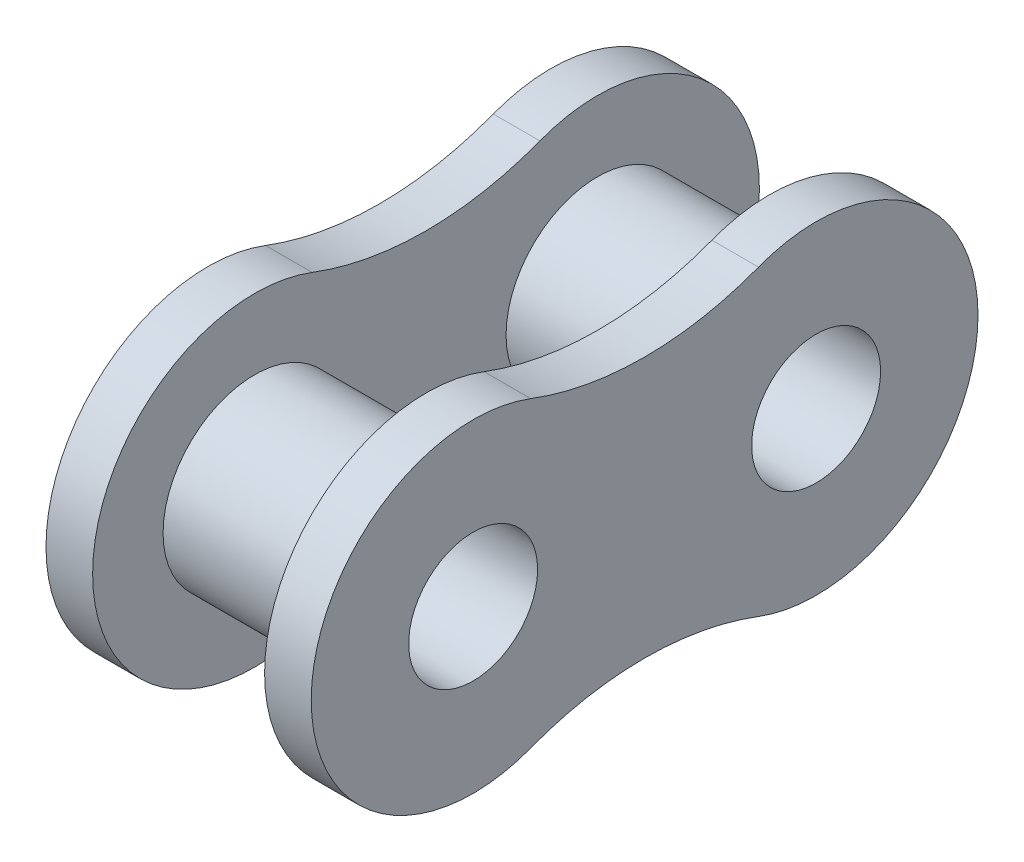
from build123d import *

# Parameters (mm, degrees)
SKETCH1_R             = 2.54
SKETCH1_R_2           = 1.7907
BOSS_EXTRUDE1_DEPTH   = 2.3876
BOSS_EXTRUDE1_2_DEPTH = 2.3876
BOSS_EXTRUDE2_START   = 2.3876
SKETCH1_4_R           = 1.7907
BOSS_EXTRUDE2_DEPTH   = 1.2954
BOSS_EXTRUDE3_START   = -2.3876
SKETCH1_5_R           = 1.7907
BOSS_EXTRUDE3_DEPTH   = 1.2954


with BuildPart() as part:
    # Sketch1 → Boss-Extrude1 (new, symmetric)
    with BuildSketch(Plane(origin=(0, 0, 0), x_dir=(0, 0, -1), z_dir=(1, 0, 0))):
        Circle(SKETCH1_R)
        Circle(SKETCH1_R_2, mode=Mode.SUBTRACT)
    extrude(amount=BOSS_EXTRUDE1_DEPTH, both=True)



with BuildPart() as body_2:
    # Sketch1 → Boss-Extrude1 2 (new, symmetric)
    with BuildSketch(Plane(origin=(0, 0, 0), x_dir=(0, 0, -1), z_dir=(1, 0, 0))):
        with Locations((9.525, 0)):
            Circle(SKETCH1_R)
        with Locations((9.525, 0)):
            Circle(SKETCH1_R_2, mode=Mode.SUBTRACT)
    extrude(amount=BOSS_EXTRUDE1_2_DEPTH, both=True)


with BuildPart() as part_1:
    add(part.part)

    add(body_2.part)  # Boss-Extrude2 merges body 2
    # Sketch1<4> → Boss-Extrude2 (add)
    with BuildSketch(Plane(origin=(0, 0, 0), x_dir=(0, 0, -1), z_dir=(1, 0, 0)).offset(BOSS_EXTRUDE2_START)):
        with BuildLine():
            ThreePointArc((7.925450664, 4.201625824), (4.7625, 3.619925475), (1.599549336, 4.201625824))
            ThreePointArc((1.599549336, 4.201625824), (-4.4958, 0), (1.599549336, -4.201625824))
            ThreePointArc((1.599549336, -4.201625824), (4.7625, -3.619925475), (7.925450664, -4.201625824))
            ThreePointArc((7.925450664, -4.201625824), (14.0208, 0), (7.925450664, 4.201625824))
        make_face()
        Circle(SKETCH1_4_R, mode=Mode.SUBTRACT)
        with Locations((9.525, 0)):
            Circle(SKETCH1_4_R, mode=Mode.SUBTRACT)
    extrude(amount=BOSS_EXTRUDE2_DEPTH)


with BuildPart() as body_2_2:
    # Sketch1<5> → Boss-Extrude3 (new body)
    with BuildSketch(Plane(origin=(0, 0, 0), x_dir=(0, 0, -1), z_dir=(1, 0, 0)).offset(BOSS_EXTRUDE3_START)):
        with BuildLine():
            ThreePointArc((1.599549336, 4.201625824), (-4.4958, 0), (1.599549336, -4.201625824))
            ThreePointArc((1.599549336, -4.201625824), (4.7625, -3.619925475), (7.925450664, -4.201625824))
            ThreePointArc((7.925450664, -4.201625824), (14.0208, 0), (7.925450664, 4.201625824))
            ThreePointArc((7.925450664, 4.201625824), (4.7625, 3.619925475), (1.599549336, 4.201625824))
        make_face()
        with Locations((9.525, 0)):
            Circle(SKETCH1_5_R, mode=Mode.SUBTRACT)
        Circle(SKETCH1_5_R, mode=Mode.SUBTRACT)
    extrude(amount=-BOSS_EXTRUDE3_DEPTH)


solid = Compound([part_1.part, body_2_2.part])
